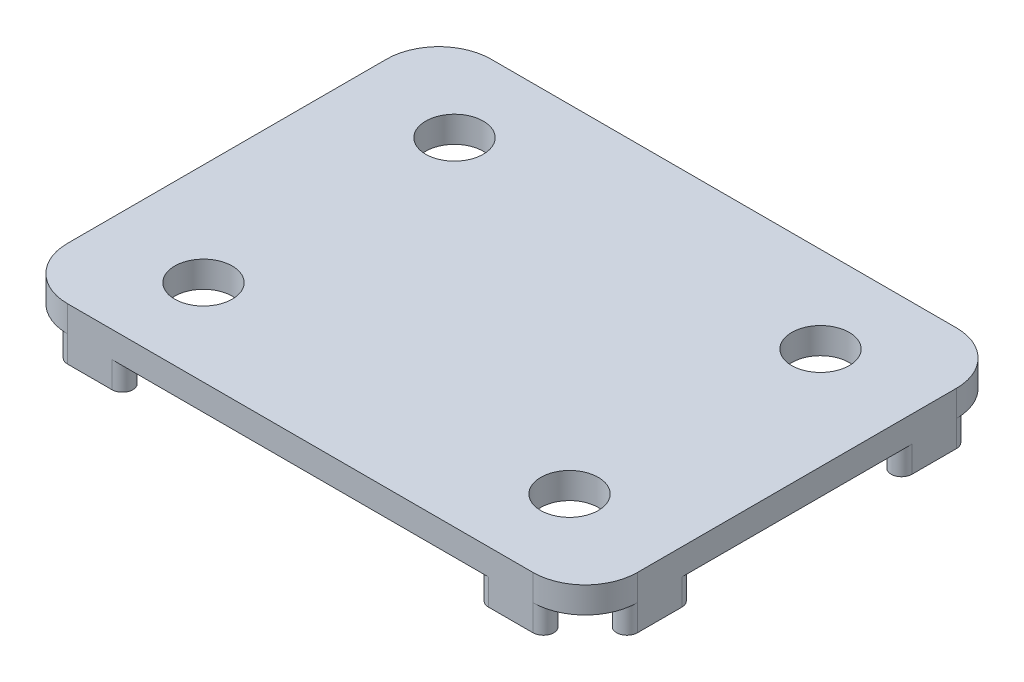
from build123d import *

# Parameters (mm, degrees)
SKETCH1_W            = 54.5
SKETCH1_H            = 40.5
BOSS_EXTRUDE1_DEPTH  = 2.5
M5_CLEARANCE_HOLE1_D = 5.5
FILLET1_R            = 5
BOSS_EXTRUDE2_DEPTH  = 2.5
MIRROR2_COPY_1_DEPTH = 2.5


with BuildPart() as part:
    # Sketch1 → Boss-Extrude1 (new body)
    with BuildSketch(Plane(origin=(0, 0, 0), x_dir=(1, 0, 0), z_dir=(0, 1, 0))):
        Rectangle(SKETCH1_W, SKETCH1_H)
    extrude(amount=BOSS_EXTRUDE1_DEPTH)

    # M5 Clearance Hole1 (through all)
    with Locations(Plane(origin=(0, 2.5, 0), x_dir=(1, 0, 0), z_dir=(0, 1, 0))):
        with Locations((17.5, -12), (-17.5, 12), (-17.5, -12), (17.5, 12)):
            Hole(M5_CLEARANCE_HOLE1_D / 2)

    # Fillet1
    fillet1_edges = [part.edges().sort_by_distance(p)[0] for p in [
        (-27.25, 1.25, -20.25),
        (27.25, 1.25, -20.25),
        (27.25, 1.25, 20.25),
        (-27.25, 1.25, 20.25),
    ]]
    fillet(fillet1_edges, radius=FILLET1_R)

    # Sketch2 → Boss-Extrude2 (add)
    with BuildSketch(Plane(origin=(0, 0, 0), x_dir=(1, 0, 0), z_dir=(0, 1, 0))):
        with BuildLine():
            Line((-25.25, 11), (-25.25, 15.25))
            ThreePointArc((-25.25, 15.25), (-26.25, 16.25), (-27.25, 15.25))
            Line((-27.25, 15.25), (-27.25, 11))
            ThreePointArc((-27.25, 11), (-26.25, 10), (-25.25, 11))
        make_face()
        with BuildLine():
            Line((-22.25, 18.25), (-18, 18.25))
            ThreePointArc((-18, 18.25), (-17, 19.25), (-18, 20.25))
            Line((-18, 20.25), (-22.25, 20.25))
            ThreePointArc((-22.25, 20.25), (-23.25, 19.25), (-22.25, 18.25))
        make_face()
    boss_extrude2 = extrude(amount=-BOSS_EXTRUDE2_DEPTH)

    # Mirror1: Boss-Extrude2 across plane
    add(boss_extrude2.mirror(Plane.XY))

    # Mirror2: Boss-Extrude2 across plane
    add(boss_extrude2.mirror(Plane(origin=(0, 0, 0), x_dir=(0, 0, 1), z_dir=(1, 0, 0))))

    # Mirror2 copy 1 sketch → Mirror2 copy 1 (add)
    with BuildSketch(Plane(origin=(0, 0, 0), x_dir=(-1, 0, 0), z_dir=(0, 1, 0))):
        with BuildLine():
            Line((-25.25, 11), (-25.25, 15.25))
            ThreePointArc((-25.25, 15.25), (-26.25, 16.25), (-27.25, 15.25))
            Line((-27.25, 15.25), (-27.25, 11))
            ThreePointArc((-27.25, 11), (-26.25, 10), (-25.25, 11))
        make_face()
        with BuildLine():
            Line((-22.25, 18.25), (-18, 18.25))
            ThreePointArc((-18, 18.25), (-17, 19.25), (-18, 20.25))
            Line((-18, 20.25), (-22.25, 20.25))
            ThreePointArc((-22.25, 20.25), (-23.25, 19.25), (-22.25, 18.25))
        make_face()
    extrude(amount=-MIRROR2_COPY_1_DEPTH)


solid = part.part
